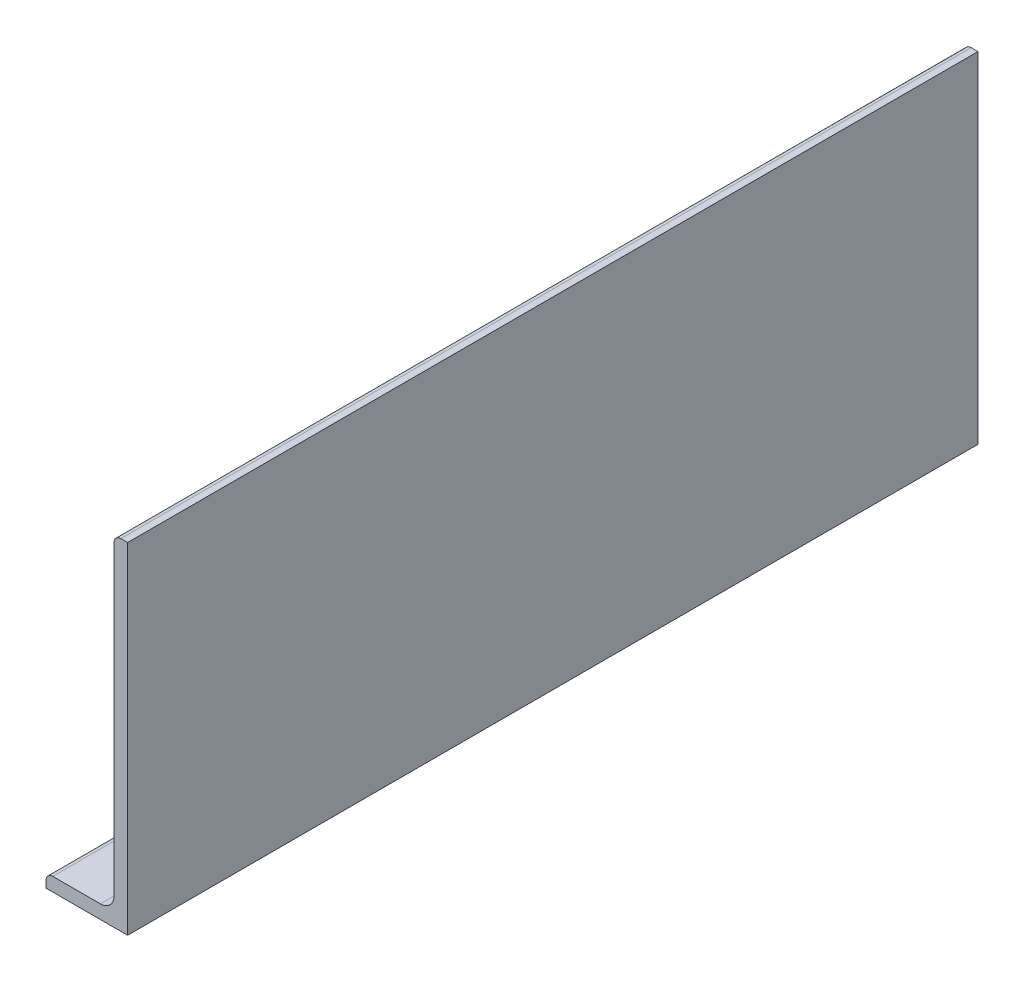
from build123d import *

# Parameters (mm, degrees)
BOSS_EXTRUDE1_DEPTH = 125
FILLET1_R           = 1
FILLET2_R           = 2
SKETCH2_R           = 1.6
CUT_EXTRUDE1_DEPTH  = 354.048952649


with BuildPart() as part:
    # Sketch1 → Boss-Extrude1 (new body)
    with BuildSketch(Plane.XY):
        Polygon((326.671950076, -19.419173914), (326.671950076, -69.419173914), (314.671950076, -69.419173914), (314.671950076, -67.419173914), (324.671950076, -67.419173914), (324.671950076, -19.419173914), align=None)
    extrude(amount=BOSS_EXTRUDE1_DEPTH)

    # Fillet1
    fillet1_edges = [part.edges().sort_by_distance(p)[0] for p in [
        (314.671950076, -67.419173914, 62.5),
        (324.671950076, -19.419173914, 62.5),
    ]]
    fillet(fillet1_edges, radius=FILLET1_R)

    # Fillet2
    fillet2_edges = [part.edges().sort_by_distance(p)[0] for p in [
        (324.671950076, -67.419173914, 62.5),
    ]]
    fillet(fillet2_edges, radius=FILLET2_R)

    # Sketch2 → Cut-Extrude1 (cut, through all)
    with BuildSketch(Plane(origin=(0, -67.419173914, 0), x_dir=(1, 0, 0), z_dir=(0, 1, 0))):
        with Locations(Location((319.171950076, -105, 0), (0, 0, 270))):
            Circle(SKETCH2_R)
        with Locations(Location((319.171950076, -20, 0), (0, 0, 270))):
            Circle(SKETCH2_R)
    extrude(amount=-CUT_EXTRUDE1_DEPTH, mode=Mode.SUBTRACT)


solid = part.part
